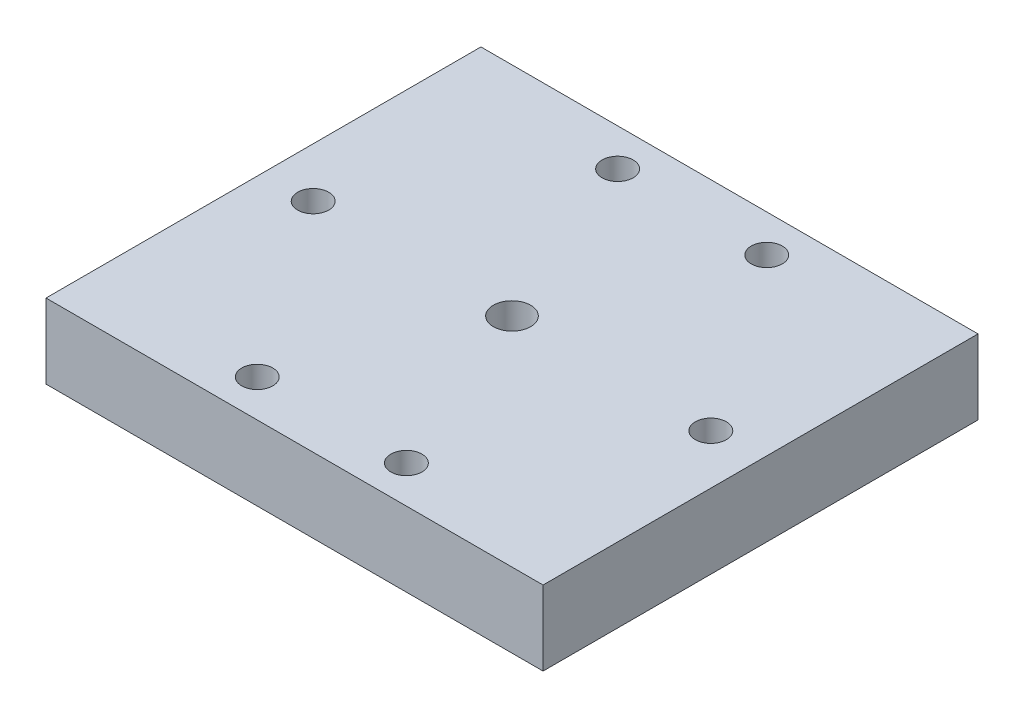
from build123d import *

# Parameters (mm, degrees)
SKETCH1_W           = 40
SKETCH1_H           = 35
SKETCH1_R           = 1.25
SKETCH1_R_2         = 1.5
BOSS_EXTRUDE1_DEPTH = 6


with BuildPart() as part:
    # Sketch1 → Boss-Extrude1 (new body)
    with BuildSketch(Plane(origin=(0, 0, 0), x_dir=(1, 0, 0), z_dir=(0, 1, 0))):
        Rectangle(SKETCH1_W, SKETCH1_H)
        with Locations(Location((16, 0, 0), (0, 0, 270))):
            Circle(SKETCH1_R, mode=Mode.SUBTRACT)
        with Locations(Location((6, -14.5, 0), (0, 0, 270))):
            Circle(SKETCH1_R, mode=Mode.SUBTRACT)
        with Locations(Location((-6, -14.5, 0), (0, 0, 270))):
            Circle(SKETCH1_R, mode=Mode.SUBTRACT)
        with Locations(Location((-16, 0, 0), (0, 0, 270))):
            Circle(SKETCH1_R, mode=Mode.SUBTRACT)
        with Locations(Location((6, 14.5, 0), (0, 0, 90))):
            Circle(SKETCH1_R, mode=Mode.SUBTRACT)
        with Locations(Location((-6, 14.5, 0), (0, 0, 90))):
            Circle(SKETCH1_R, mode=Mode.SUBTRACT)
        with Locations(Location((0, 0, 0), (0, 0, 270))):
            Circle(SKETCH1_R_2, mode=Mode.SUBTRACT)
    extrude(amount=BOSS_EXTRUDE1_DEPTH)


solid = part.part
